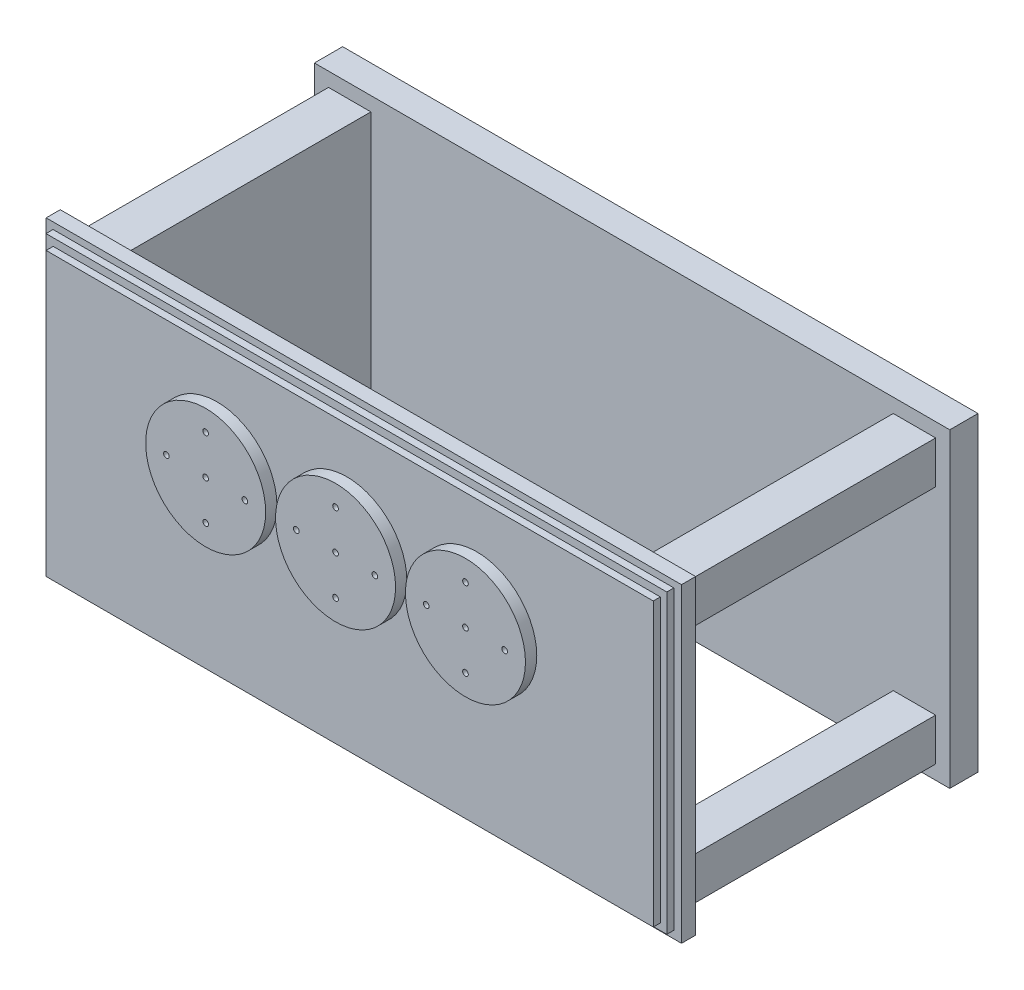
from build123d import *

# Parameters (mm, degrees)
SKETCH1_W                = 450
SKETCH1_H                = 220
BOSS_EXTRUDE2_DEPTH      = 20
BOSS_EXTRUDE3_DEPTH      = 200
BOSS_EXTRUDE3_DEPTH_BACK = 20
SKETCH4_W                = 30
SKETCH4_H                = 30
BOSS_EXTRUDE4_DEPTH      = 10
BOSS_EXTRUDE5_DEPTH      = 5
SKETCH9_R                = 42.5
BOSS_EXTRUDE7_DEPTH      = 8
BOSS_EXTRUDE7_2_DEPTH    = 8
BOSS_EXTRUDE7_3_DEPTH    = 8
SKETCH14_W               = 180
SKETCH14_H               = 200
BOSS_EXTRUDE9_DEPTH      = 30
SKETCH16_W               = 430
SKETCH16_H               = 200
BOSS_EXTRUDE10_DEPTH     = 5
SKETCH15_R               = 2
CUT_EXTRUDE2_DEPTH       = 125


with BuildPart() as part:
    # Sketch1 → Boss-Extrude2 (new body)
    with BuildSketch(Plane.XY):
        Rectangle(SKETCH1_W, SKETCH1_H)
    extrude(amount=BOSS_EXTRUDE2_DEPTH)

    # Sketch4 → Boss-Extrude3 (add, two sides: drawn at the far end of the back side and taken through both)
    with BuildSketch(Plane.XY.offset(20).offset(-BOSS_EXTRUDE3_DEPTH_BACK)):
        with Locations((-200, -85)):
            Rectangle(SKETCH4_W, SKETCH4_H)
        with Locations((200, -85)):
            Rectangle(SKETCH4_W, SKETCH4_H)
        with Locations((200, 85)):
            Rectangle(SKETCH4_W, SKETCH4_H)
        with Locations((-200, 85)):
            Rectangle(SKETCH4_W, SKETCH4_H)
    extrude(amount=BOSS_EXTRUDE3_DEPTH + BOSS_EXTRUDE3_DEPTH_BACK)

    # 3DSketch1 → Boss-Extrude4 (add)
    with BuildSketch(Plane(origin=(-225, 110, 200), x_dir=(0.8983843609192008, -0.43921013200494263, 0), z_dir=(0, 0, 1))):
        Polygon((0, 0), (404.272962414, 197.644559402), (500.899191455, 0), (96.626229041, -197.644559402), align=None)
    extrude(amount=BOSS_EXTRUDE4_DEPTH)

    # Sketch6 → Boss-Extrude5 (add)
    with BuildSketch(Plane.XY.offset(210)):
        Polygon((89.902869194, 105.308220181), (219.583734221, 105.308220181), (219.583734221, -104.691779819), (89.902869194, -104.691779819), (-220.097130806, -104.691779819), (-220.097130806, 105.308220181), align=None)
    extrude(amount=BOSS_EXTRUDE5_DEPTH)

    # Sketch14 → Boss-Extrude9 (add)
    with BuildSketch(Plane.ZY.offset(215)):
        with Locations((110, 0)):
            Rectangle(SKETCH14_W, SKETCH14_H)
    extrude(amount=-BOSS_EXTRUDE9_DEPTH)

    # Sketch16 → Boss-Extrude10 (add)
    with BuildSketch(Plane.XY.offset(215)):
        Rectangle(SKETCH16_W, SKETCH16_H)
    extrude(amount=BOSS_EXTRUDE10_DEPTH)


with BuildPart() as body_2:
    # Sketch9 → Boss-Extrude7 (new body)
    with BuildSketch(Plane.XY.offset(220)):
        with Locations((-94.016089857, 25.179961457)):
            Circle(SKETCH9_R)
    extrude(amount=BOSS_EXTRUDE7_DEPTH)


with BuildPart() as body_3:
    # Sketch9 → Boss-Extrude7 2 (new body)
    with BuildSketch(Plane.XY.offset(220)):
        with Locations((-2.016089857, 25.179961457)):
            Circle(SKETCH9_R)
    extrude(amount=BOSS_EXTRUDE7_2_DEPTH)


with BuildPart() as body_4:
    # Sketch9 → Boss-Extrude7 3 (new body)
    with BuildSketch(Plane.XY.offset(220)):
        with Locations((89.983910143, 25.179961457)):
            Circle(SKETCH9_R)
    extrude(amount=BOSS_EXTRUDE7_3_DEPTH)


with BuildPart() as cut_extrude2_tool:
    # Sketch15 → Cut-Extrude2 (new body)
    with BuildSketch(Plane.XY.offset(228)):
        with Locations((-94.016089857, 52.976022807)):
            Circle(SKETCH15_R)
        with Locations((-66.220028508, 25.179961457)):
            Circle(SKETCH15_R)
        with Locations((-94.016089857, -2.616099892)):
            Circle(SKETCH15_R)
        with Locations((-121.812151206, 25.179961457)):
            Circle(SKETCH15_R)
        with Locations((-2.016089857, 52.976022807)):
            Circle(SKETCH15_R)
        with Locations((-29.812151206, 25.179961457)):
            Circle(SKETCH15_R)
        with Locations((-2.016089857, -2.616099892)):
            Circle(SKETCH15_R)
        with Locations((25.779971492, 25.179961457)):
            Circle(SKETCH15_R)
        with Locations((89.983910143, 52.976022807)):
            Circle(SKETCH15_R)
        with Locations((62.187848794, 25.179961457)):
            Circle(SKETCH15_R)
        with Locations((89.983910143, -2.616099892)):
            Circle(SKETCH15_R)
        with Locations((117.779971492, 25.179961457)):
            Circle(SKETCH15_R)
        with Locations((-94.016089857, 25.179961457)):
            Circle(SKETCH15_R)
        with Locations((-2.016089857, 25.179961457)):
            Circle(SKETCH15_R)
        with Locations((89.983910143, 25.179961457)):
            Circle(SKETCH15_R)
    extrude(amount=-CUT_EXTRUDE2_DEPTH)


with BuildPart() as part_1:
    add(part.part)

    # Cut-Extrude2: cut by cut_extrude2_tool
    add(cut_extrude2_tool.part, mode=Mode.SUBTRACT)


with BuildPart() as body_2_1:
    add(body_2.part)

    # Cut-Extrude2: cut by cut_extrude2_tool
    add(cut_extrude2_tool.part, mode=Mode.SUBTRACT)


with BuildPart() as body_3_1:
    add(body_3.part)

    # Cut-Extrude2: cut by cut_extrude2_tool
    add(cut_extrude2_tool.part, mode=Mode.SUBTRACT)


with BuildPart() as body_4_1:
    add(body_4.part)

    # Cut-Extrude2: cut by cut_extrude2_tool
    add(cut_extrude2_tool.part, mode=Mode.SUBTRACT)


solid = Compound([part_1.part, body_2_1.part, body_3_1.part, body_4_1.part])
